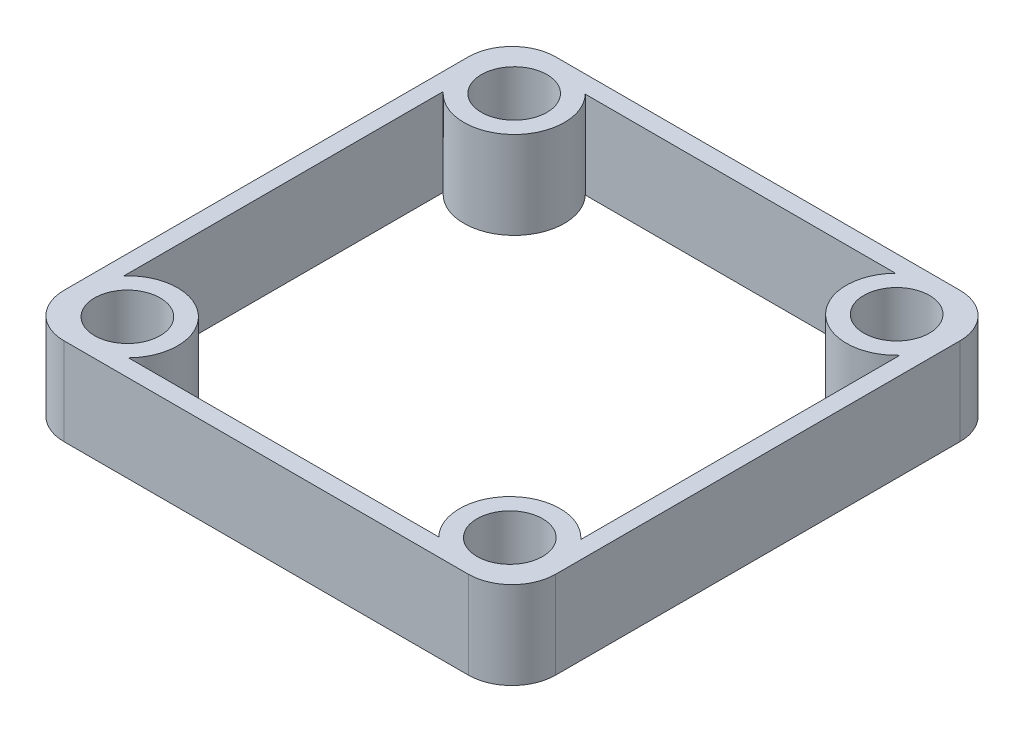
from build123d import *

# Parameters (mm, degrees)
SKETCH1_R           = 1.5
BOSS_EXTRUDE1_DEPTH = 4


with BuildPart() as part:
    # Sketch1 → Boss-Extrude1 (new body)
    with BuildSketch(Plane(origin=(0, 0, 0), x_dir=(1, 0, 0), z_dir=(0, 1, 0))):
        with BuildLine():
            Line((-9.25, 11.25), (9.25, 11.25))
            ThreePointArc((9.25, 11.25), (10.664213562, 10.664213562), (11.25, 9.25))
            Line((11.25, 9.25), (11.25, -9.25))
            ThreePointArc((11.25, -9.25), (10.664213562, -10.664213562), (9.25, -11.25))
            Line((9.25, -11.25), (-9.25, -11.25))
            ThreePointArc((-9.25, -11.25), (-10.664213562, -10.664213562), (-11.25, -9.25))
            Line((-11.25, -9.25), (-11.25, 9.25))
            ThreePointArc((-11.25, 9.25), (-10.664213562, 10.664213562), (-9.25, 11.25))
        make_face()
        with Locations(Location((8.75, 8.85, 0), (0, 0, 270))):
            Circle(SKETCH1_R, mode=Mode.SUBTRACT)
        with Locations(Location((8.75, -8.85, 0), (0, 0, 90))):
            Circle(SKETCH1_R, mode=Mode.SUBTRACT)
        with Locations(Location((-8.75, 8.85, 0), (0, 0, 90))):
            Circle(SKETCH1_R, mode=Mode.SUBTRACT)
        with Locations(Location((-8.75, -8.85, 0), (0, 0, 270))):
            Circle(SKETCH1_R, mode=Mode.SUBTRACT)
        with BuildLine():
            Line((-7.097728836, 10.45), (7.097728836, 10.45))
            ThreePointArc((7.097728836, 10.45), (7.175222498, 7.173671924), (10.45, 7.300806662))
            Line((10.45, 7.300806662), (10.45, -7.300806662))
            ThreePointArc((10.45, -7.300806662), (7.175222498, -7.173671924), (7.097728836, -10.45))
            Line((7.097728836, -10.45), (-7.097728836, -10.45))
            ThreePointArc((-7.097728836, -10.45), (-7.175222498, -7.173671924), (-10.45, -7.300806662))
            Line((-10.45, -7.300806662), (-10.45, 7.300806662))
            ThreePointArc((-10.45, 7.300806662), (-7.175222498, 7.173671924), (-7.097728836, 10.45))
        make_face(mode=Mode.SUBTRACT)
    extrude(amount=BOSS_EXTRUDE1_DEPTH)


solid = part.part
